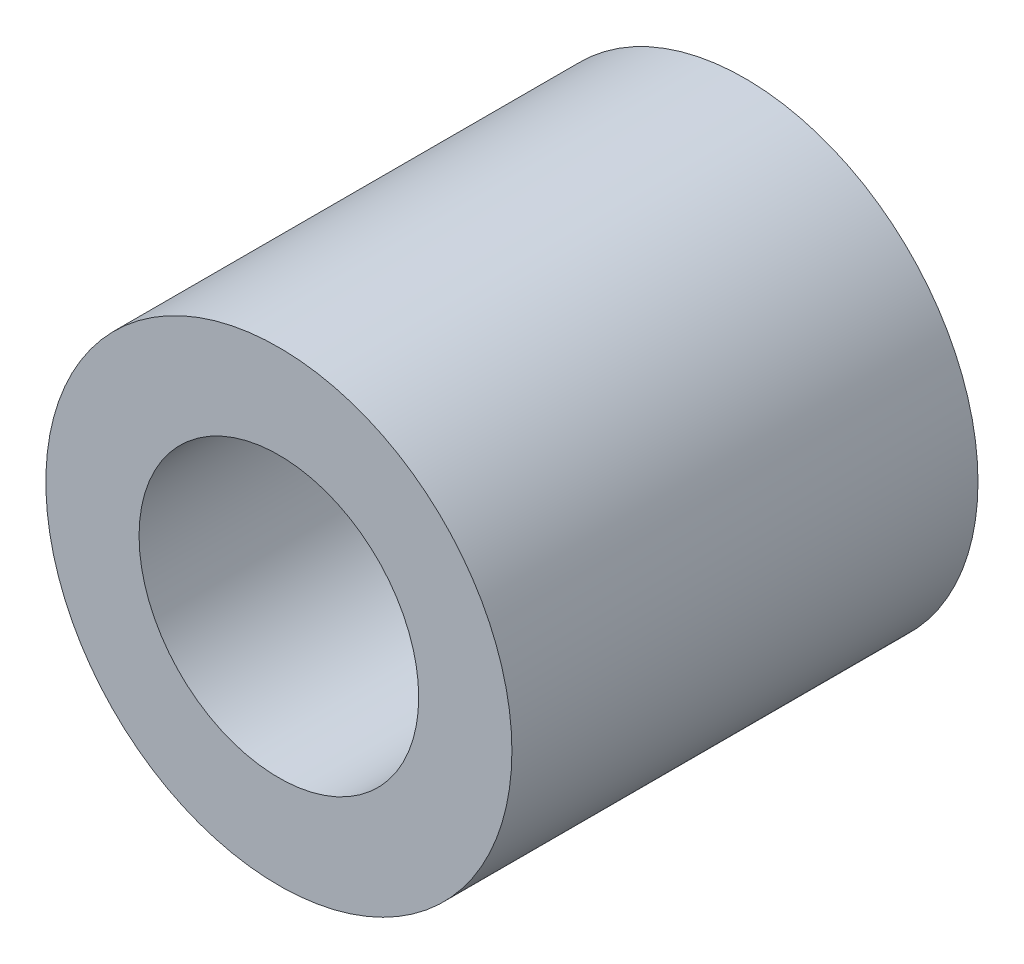
from build123d import *

# Parameters (mm, degrees)
CROQUIS1_R              = 2.5
SALIENTE_EXTRUIR1_DEPTH = 5
CORTAR_EXTRUIR1_REACH   = 8.124
CROQUIS2_R              = 1.5


with BuildPart() as part:
    # Croquis1 → Saliente-Extruir1 (new body)
    with BuildSketch(Plane.XY):
        Circle(CROQUIS1_R)
    extrude(amount=SALIENTE_EXTRUIR1_DEPTH)

    # Croquis2 → Cortar-Extruir1 (cut, up to next)
    with BuildSketch(Plane.XY.offset(5), mode=Mode.PRIVATE) as cortar_extruir1_sk1:
        Circle(CROQUIS2_R)
    cortar_extruir1_tool1 = extrude(cortar_extruir1_sk1.sketch, amount=-CORTAR_EXTRUIR1_REACH, mode=Mode.PRIVATE) & part.part
    add(cortar_extruir1_tool1.solids().sort_by_distance((0, 0, 5))[0], mode=Mode.SUBTRACT)


solid = part.part
